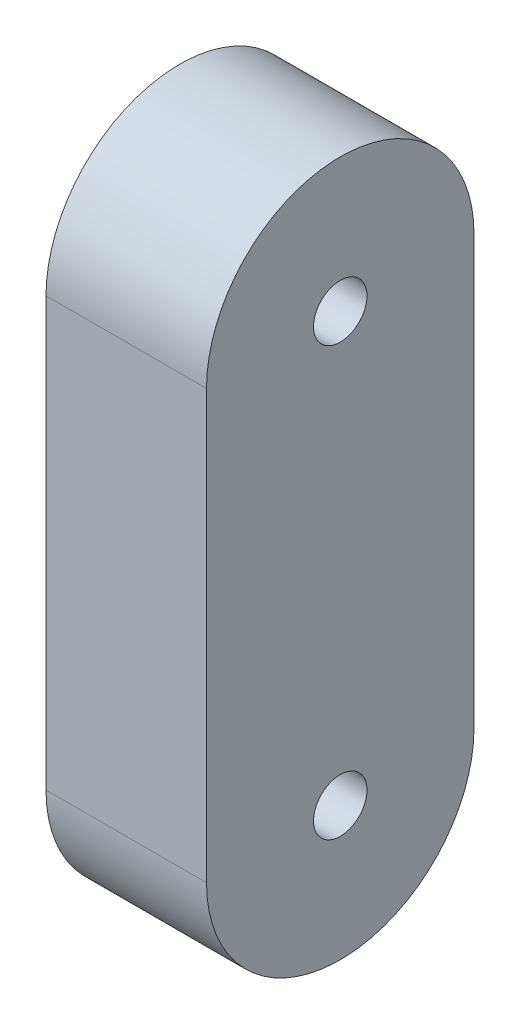
from build123d import *

# Parameters (mm, degrees)
BOSS_EXTRUDE1_DEPTH = 30
SKETCH2_R           = 5
CUT_EXTRUDE1_DEPTH  = 30


with BuildPart() as part:
    # Sketch1 → Boss-Extrude1 (new body)
    with BuildSketch(Plane(origin=(0, 0, 0), x_dir=(0, 0, -1), z_dir=(1, 0, 0))):
        with BuildLine():
            Line((-25, 40), (-25, -40))
            ThreePointArc((-25, -40), (0, -65), (25, -40))
            Line((25, -40), (25, 40))
            ThreePointArc((25, 40), (0, 65), (-25, 40))
        make_face()
    extrude(amount=BOSS_EXTRUDE1_DEPTH)

    # Sketch2 → Cut-Extrude1 (cut)
    with BuildSketch(Plane(origin=(30, 0, 0), x_dir=(0, 0, -1), z_dir=(1, 0, 0))):
        with Locations((0, 40)):
            Circle(SKETCH2_R)
        with Locations((0, -40)):
            Circle(SKETCH2_R)
    extrude(amount=-CUT_EXTRUDE1_DEPTH, mode=Mode.SUBTRACT)


solid = part.part
